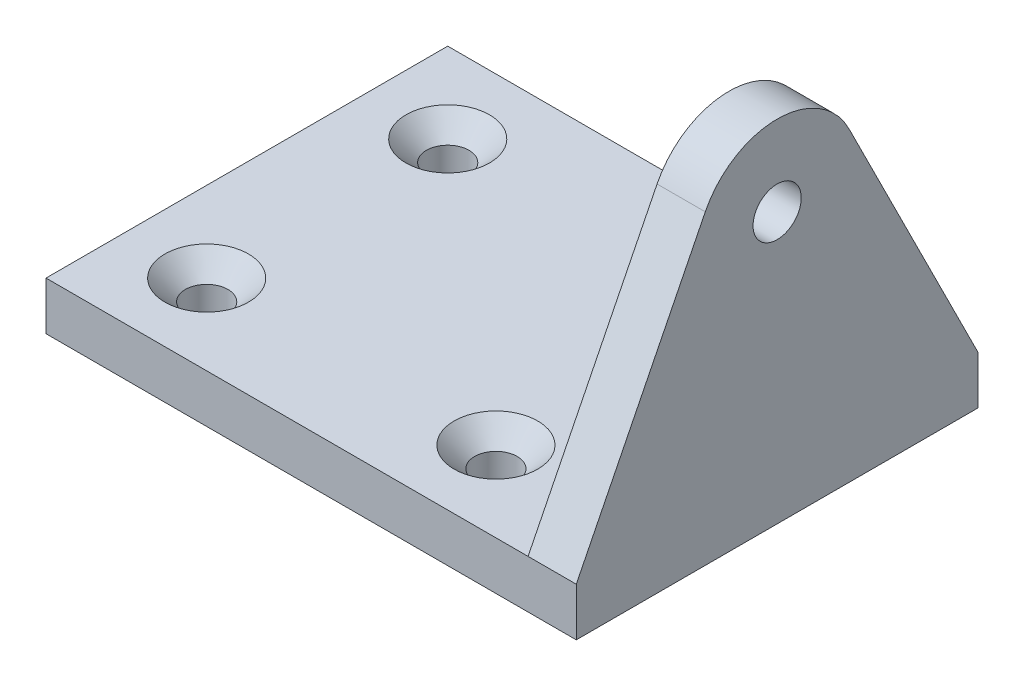
from build123d import *

# Parameters (mm, degrees)
SKETCH1_W                                            = 60
SKETCH1_H                                            = 50
BOSS_EXTRUDE1_DEPTH                                  = 6
CSK_FOR_M5_COUNTERSUNK_RAISED_HEAD_SCREW_D           = 5.3
CSK_FOR_M5_COUNTERSUNK_RAISED_HEAD_SCREW_CSINK_D     = 10.4
CSK_FOR_M5_COUNTERSUNK_RAISED_HEAD_SCREW_CSINK_ANGLE = 90
BOSS_EXTRUDE2_DEPTH                                  = 6
SKETCH6_R                                            = 3
CUT_EXTRUDE1_DEPTH                                   = 6


with BuildPart() as part:
    # Sketch1 → Boss-Extrude1 (new body)
    with BuildSketch(Plane(origin=(0, 0, 0), x_dir=(1, 0, 0), z_dir=(0, 1, 0))):
        Rectangle(SKETCH1_W, SKETCH1_H)
    extrude(amount=BOSS_EXTRUDE1_DEPTH)

    # CSK for M5 Countersunk Raised Head Screw1 (through all)
    with Locations(Plane(origin=(0, 6, 0), x_dir=(1, 0, 0), z_dir=(0, 1, 0))):
        with Locations((-20, -15), (16, -15), (16, 15), (-20, 15)):
            CounterSinkHole(CSK_FOR_M5_COUNTERSUNK_RAISED_HEAD_SCREW_D / 2, CSK_FOR_M5_COUNTERSUNK_RAISED_HEAD_SCREW_CSINK_D / 2, counter_sink_angle=CSK_FOR_M5_COUNTERSUNK_RAISED_HEAD_SCREW_CSINK_ANGLE)

    # Sketch5 → Boss-Extrude2 (add)
    with BuildSketch(Plane(origin=(30, 0, 0), x_dir=(0, 0, -1), z_dir=(1, 0, 0))):
        with BuildLine():
            Line((-25, 6), (-8.94427191, 38.11145618))
            ThreePointArc((-8.94427191, 38.11145618), (0, 43.639320225), (8.94427191, 38.11145618))
            Line((8.94427191, 38.11145618), (25, 6))
            Line((25, 6), (25, 0))
            Line((25, 0), (-25, 0))
            Line((-25, 0), (-25, 6))
        make_face()
    extrude(amount=BOSS_EXTRUDE2_DEPTH)

    # Sketch6 → Cut-Extrude1 (cut)
    with BuildSketch(Plane(origin=(36, 0, 0), x_dir=(0, 0, -1), z_dir=(1, 0, 0))):
        with Locations((0, 33.639320225)):
            Circle(SKETCH6_R)
    extrude(amount=-CUT_EXTRUDE1_DEPTH, mode=Mode.SUBTRACT)


solid = part.part
